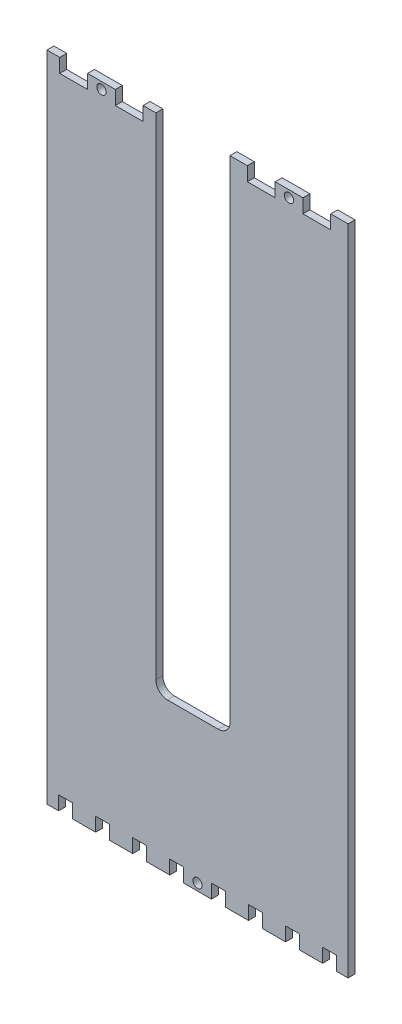
from build123d import *

# Parameters (mm, degrees)
ESQUISSE1_W             = 130
ESQUISSE1_H             = 282
BOSS_EXTRU_1_DEPTH      = 3
ESQUISSE2_W             = 32
ESQUISSE2_H             = 217
ENL_V_MAT_EXTRU_1_DEPTH = 3
CONG_1_R                = 5
ESQUISSE3_R             = 2
ESQUISSE3_W             = 12
ESQUISSE3_H             = 6
ESQUISSE3_W_2           = 6
ENL_V_MAT_EXTRU_2_DEPTH = 3


with BuildPart() as part:
    # Esquisse1 → Boss.-Extru.1 (new body)
    with BuildSketch(Plane.XY):
        with Locations((18.458602023, -91.280290456)):
            Rectangle(ESQUISSE1_W, ESQUISSE1_H)
    extrude(amount=BOSS_EXTRU_1_DEPTH)

    # Esquisse2 → Enlèv. mat.-Extru.1 (cut)
    with BuildSketch(Plane.XY.offset(3)):
        with Locations((16.458602023, -58.780290456)):
            Rectangle(ESQUISSE2_W, ESQUISSE2_H)
    extrude(amount=-ENL_V_MAT_EXTRU_1_DEPTH, mode=Mode.SUBTRACT)

    # Congé1
    cong_1_edges = [part.edges().sort_by_distance(p)[0] for p in [
        (32.458602023, -167.280290456, 1.5),
        (0.458602023, -167.280290456, 1.5),
    ]]
    fillet(cong_1_edges, radius=CONG_1_R)

    # Esquisse3 → Enlèv. mat.-Extru.2 (cut)
    with BuildSketch(Plane.XY.offset(3)):
        with Locations((-23.041397977, 46.719709544)):
            Circle(ESQUISSE3_R)
        with Locations((57.958602023, 46.719709544)):
            Circle(ESQUISSE3_R)
        with Locations((18.458602023, -229.280290456)):
            Circle(ESQUISSE3_R)
        with Locations((-35.041397977, 46.719709544)):
            Rectangle(ESQUISSE3_W, ESQUISSE3_H)
        with Locations((-11.041397977, 46.719709544)):
            Rectangle(ESQUISSE3_W, ESQUISSE3_H)
        with Locations((45.958602023, 46.719709544)):
            Rectangle(ESQUISSE3_W, ESQUISSE3_H)
        with Locations((69.958602023, 46.719709544)):
            Rectangle(ESQUISSE3_W, ESQUISSE3_H)
        with Locations((9.458602023, -229.280290456)):
            Rectangle(ESQUISSE3_W_2, ESQUISSE3_H)
        with Locations((-6.541397977, -229.280290456)):
            Rectangle(ESQUISSE3_W_2, ESQUISSE3_H)
        with Locations((-38.541397977, -229.280290456)):
            Rectangle(ESQUISSE3_W_2, ESQUISSE3_H)
        with Locations((27.458602023, -229.280290456)):
            Rectangle(ESQUISSE3_W_2, ESQUISSE3_H)
        with Locations((43.458602023, -229.280290456)):
            Rectangle(ESQUISSE3_W_2, ESQUISSE3_H)
        with Locations((75.458602023, -229.280290456)):
            Rectangle(ESQUISSE3_W_2, ESQUISSE3_H)
        with Locations((-22.541397977, -229.280290456)):
            Rectangle(ESQUISSE3_W_2, ESQUISSE3_H)
        with Locations((59.458602023, -229.280290456)):
            Rectangle(ESQUISSE3_W_2, ESQUISSE3_H)
    extrude(amount=-ENL_V_MAT_EXTRU_2_DEPTH, mode=Mode.SUBTRACT)


solid = part.part
